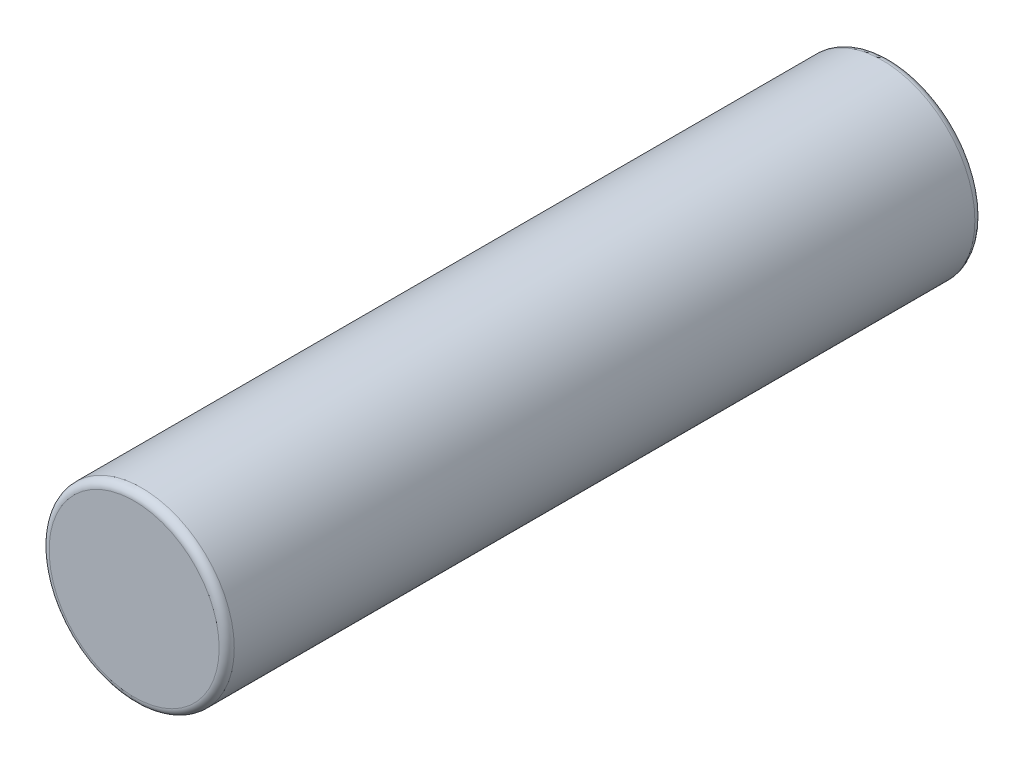
from build123d import *

# Parameters (mm, degrees)
CROQUIS1_R              = 2.45
SALIENTE_EXTRUIR1_DEPTH = 20
REDONDEO1_R             = 0.2


with BuildPart() as part:
    # Croquis1 → Saliente-Extruir1 (new body)
    with BuildSketch(Plane.XY):
        Circle(CROQUIS1_R)
    extrude(amount=SALIENTE_EXTRUIR1_DEPTH)

    # Redondeo1
    redondeo1_edges = [part.edges().sort_by_distance(p)[0] for p in [
        (-2.45, 0, 0),
        (-2.45, 0, 20),
    ]]
    fillet(redondeo1_edges, radius=REDONDEO1_R)


solid = part.part
